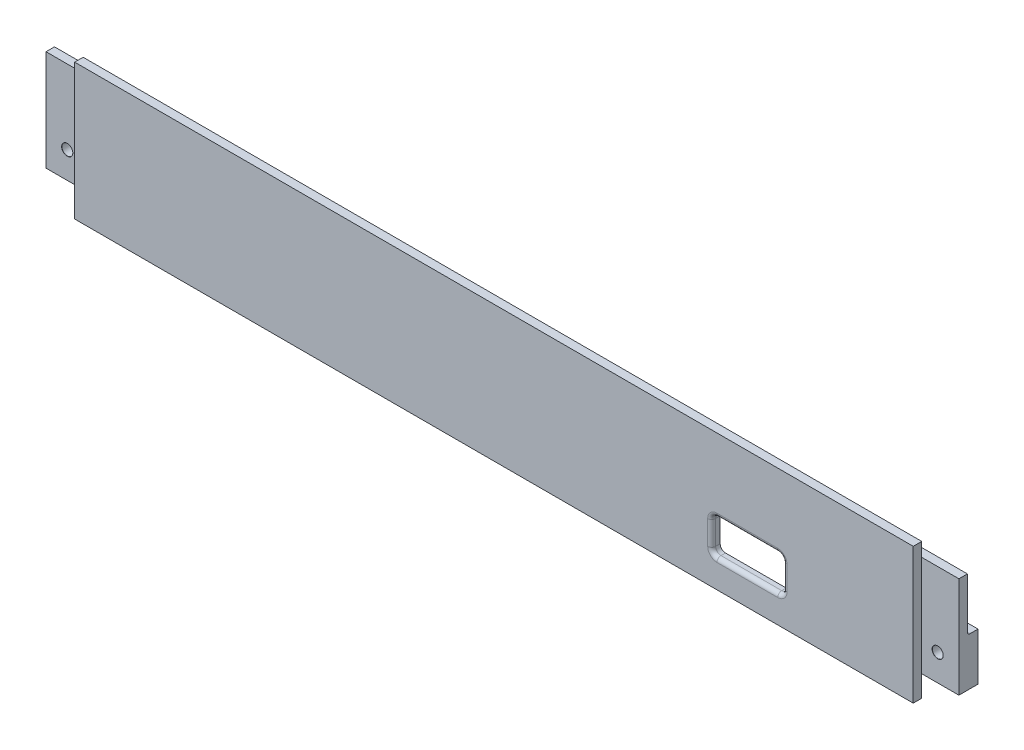
from build123d import *

# Parameters (mm, degrees)
SKETCH1_W                                = 158
SKETCH1_H                                = 25.6
PRIMARY_BACKPLATE_DEPTH                  = 1.6
SKETCH2_W                                = 172
SKETCH2_H                                = 19
PLATE_THICKENER_DEPTH                    = 1.6
SKETCH13_W                               = 9
SKETCH13_H                               = 9
THICKER_REAR_BOLT_BLOCKS_DEPTH           = 2
TAP_DRILL_FOR_M2_5X0_45_TAP3_D           = 2.05
TAP_DRILL_FOR_M2_5X0_45_TAP3_CSINK_D     = 2.1
TAP_DRILL_FOR_M2_5X0_45_TAP3_CSINK_ANGLE = 90
SKETCH7_W                                = 8
SKETCH7_H                                = 7
SKETCH7_R                                = 1.3
MOUNTING_BOSSES_DEPTH                    = 4
MOUNTING_BOSSES_2_DEPTH                  = 4
USB_HOLE_DEPTH                           = 91.001999978
USB_HOLE_DEPTH_BACK                      = 91.001999978
SKETCH8_W                                = 13.43739998
SKETCH8_H                                = 6.546680298
FILLET1_R                                = 0.5
SKETCH9_W                                = 29.257163278
SKETCH9_H                                = 15.778717932
MODULE_RELIEF_DEPTH                      = 1.6
FILLET2_R                                = 1
FILLET3_R                                = 0.75
SKETCH12_W                               = 3.613166431
SKETCH12_H                               = 1.901681258
LED_HOLE_DEPTH                           = 3


with BuildPart() as part:
    # Sketch1 → Primary backplate (new body)
    with BuildSketch(Plane.XY):
        with Locations((0, 12.8)):
            Rectangle(SKETCH1_W, SKETCH1_H)
    extrude(amount=PRIMARY_BACKPLATE_DEPTH)

    # Sketch2 → Plate thickener (add)
    with BuildSketch(Plane.XY):
        with Locations((0, 13.5)):
            Rectangle(SKETCH2_W, SKETCH2_H)
    extrude(amount=-PLATE_THICKENER_DEPTH)

    # Sketch13 → Thicker rear bolt blocks (add)
    with BuildSketch(Plane(origin=(0, 0, -1.6), x_dir=(-1, 0, 0), z_dir=(0, 0, -1))):
        with Locations((-81.5, 8.5)):
            Rectangle(SKETCH13_W, SKETCH13_H)
        with Locations((81.5, 8.5)):
            Rectangle(SKETCH13_W, SKETCH13_H)
    extrude(amount=THICKER_REAR_BOLT_BLOCKS_DEPTH)

    # Tap Drill for M2.5x0.45 Tap3 (through all)
    with Locations(Plane(origin=(-82, 9, 0), x_dir=(1, 0, 0), z_dir=(0, 0, 1))):
        with Locations((0, 0), (164, 0)):
            CounterSinkHole(TAP_DRILL_FOR_M2_5X0_45_TAP3_D / 2, TAP_DRILL_FOR_M2_5X0_45_TAP3_CSINK_D / 2, counter_sink_angle=TAP_DRILL_FOR_M2_5X0_45_TAP3_CSINK_ANGLE)

    # Sketch8 → USB hole (cut, two sides: drawn at the far end of the back side and taken through both)
    with BuildSketch(Plane.XY.offset(-USB_HOLE_DEPTH_BACK)):
        with Locations((47.742572722, 8.497650706)):
            Rectangle(SKETCH8_W, SKETCH8_H)
    extrude(amount=USB_HOLE_DEPTH + USB_HOLE_DEPTH_BACK, mode=Mode.SUBTRACT)


with BuildPart() as body_2:
    # Sketch7 → Mounting bosses (new body)
    with BuildSketch(Plane(origin=(0, 1.6, 0), x_dir=(1, 0, 0), z_dir=(0, 1, 0))):
        with Locations((-56.9, 3.5)):
            Rectangle(SKETCH7_W, SKETCH7_H)
        with Locations(Location((-56.9, 4.51, 0), (0, 0, 270))):
            Circle(SKETCH7_R, mode=Mode.SUBTRACT)
    extrude(amount=MOUNTING_BOSSES_DEPTH)


with BuildPart() as body_3:
    # Sketch7 → Mounting bosses 2 (new body)
    with BuildSketch(Plane(origin=(0, 1.6, 0), x_dir=(1, 0, 0), z_dir=(0, 1, 0))):
        with Locations((66.9, 3.5)):
            Rectangle(SKETCH7_W, SKETCH7_H)
        with Locations(Location((66.9, 4.51, 0), (0, 0, 270))):
            Circle(SKETCH7_R, mode=Mode.SUBTRACT)
    extrude(amount=MOUNTING_BOSSES_2_DEPTH)


with BuildPart() as part_1:
    add(part.part)

    # Combine1: union body 3, body 2
    add(body_3.part)
    add(body_2.part)

    # Fillet1
    fillet1_edges = [part_1.edges().sort_by_distance(p)[0] for p in [
        (-56.9, 5.6, -1.6),
        (66.9, 5.6, -1.6),
        (70.9, 4.8, -1.6),
        (62.9, 4.8, -1.6),
        (-60.9, 4.8, -1.6),
        (-52.9, 4.8, -1.6),
        (77, 8.5, -1.6),
        (81.5, 13, -1.6),
        (-81.5, 13, -1.6),
        (-77, 8.5, -1.6),
    ]]
    fillet(fillet1_edges, radius=FILLET1_R)

    # Sketch9 → module relief (cut)
    with BuildSketch(Plane(origin=(0, 0, -1.6), x_dir=(-1, 0, 0), z_dir=(0, 0, -1))):
        with Locations((-47.06304244, 8.354907592)):
            Rectangle(SKETCH9_W, SKETCH9_H)
    extrude(amount=-MODULE_RELIEF_DEPTH, mode=Mode.SUBTRACT)

    # Fillet2
    fillet2_edges = [part_1.edges().sort_by_distance(p)[0] for p in [
        (54.461272712, 11.770990855, 0.8),
        (41.023872732, 11.770990855, 0.8),
        (41.023872732, 5.224310557, 0.8),
        (54.461272712, 5.224310557, 0.8),
    ]]
    fillet(fillet2_edges, radius=FILLET2_R)

    # Fillet3
    fillet3_edges = [part_1.edges().sort_by_distance(p)[0] for p in [
        (47.742572722, 5.224310557, 1.6),
        (41.023872732, 8.497650706, 1.6),
        (54.461272712, 8.497650706, 1.6),
        (47.742572722, 11.770990855, 1.6),
        (41.31676595, 5.517203775, 1.6),
        (54.168379493, 5.517203775, 1.6),
        (54.168379493, 11.478097636, 1.6),
        (41.31676595, 11.478097636, 1.6),
    ]]
    fillet(fillet3_edges, radius=FILLET3_R)

    # Sketch12 → LED hole (cut)
    with BuildSketch(Plane(origin=(0, 0, -1.6), x_dir=(-1, 0, 0), z_dir=(0, 0, -1))):
        with Locations((-22.440360865, 2.876256908)):
            Rectangle(SKETCH12_W, SKETCH12_H)
    extrude(amount=-LED_HOLE_DEPTH, mode=Mode.SUBTRACT)


solid = part_1.part
